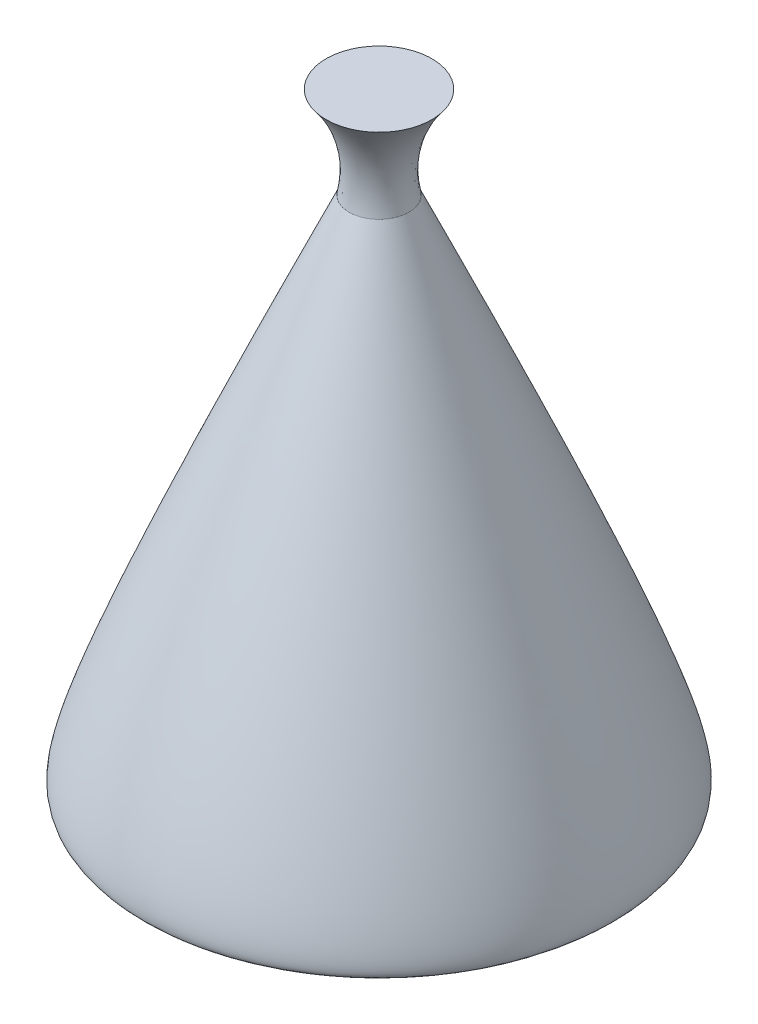
from build123d import *


with BuildPart() as part:
    # Sketch3 → Revolve9 (revolve)
    with BuildSketch(Plane.XY):
        with BuildLine():
            Line((-10.551006451, -21.751386889), (0, -21.751386889))
            Line((0, -21.751386889), (0, 5.839987342))
            Line((0, 5.839987342), (-2.408718521, 5.839987342))
            add(Edge.make_bspline(
                [(-1.361497588, 1.661793228), (-0.899570843, 3.891106641), (-2.408718521, 5.839987342)],
                knots=[0, 0, 0, 1, 1, 1], degree=2))
            add(Edge.make_bspline(
                [(-1.361497588, 1.661793228), (-11.926585633, -21.751386889), (-10.551006451, -21.751386889)],
                knots=[0, 0, 0, 1, 1, 1], degree=2))
        make_face()
    revolve(axis=Axis((0, 10.839555672, 0), (0, -1, 0)))


solid = part.part
